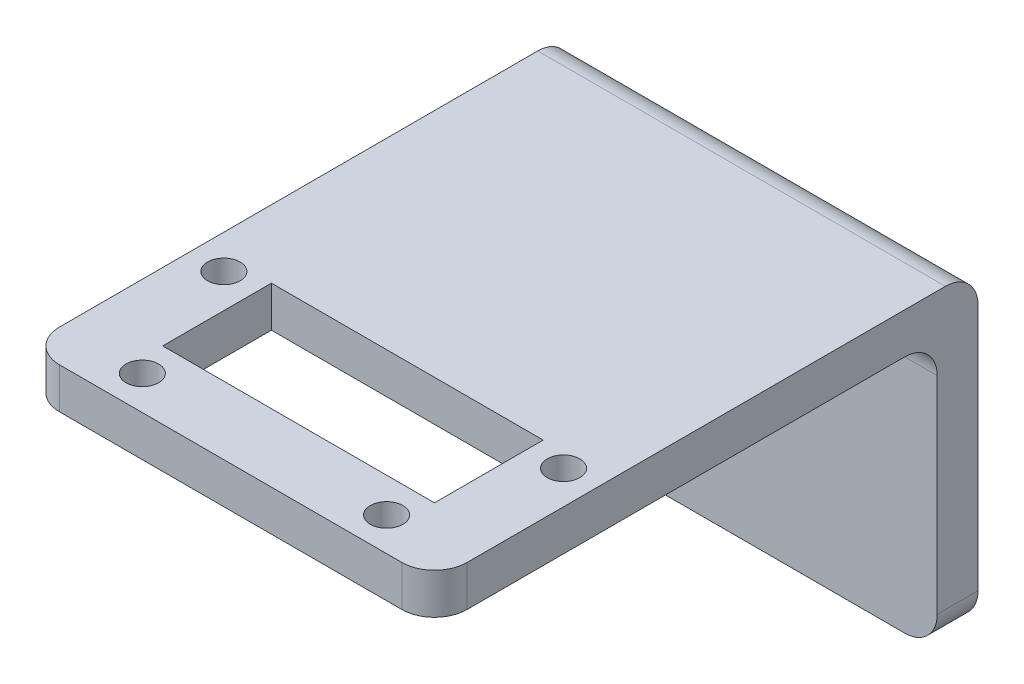
from build123d import *

# Parameters (mm, degrees)
ESBO_O1_W                = 30
ESBO_O1_H                = 40
RESSALTO_EXTRUS_O1_DEPTH = 3
ESBO_O2_W                = 20
ESBO_O2_H                = 8
CORTE_EXTRUS_O1_DEPTH    = 26.179356624
ESBO_O3_R                = 1.2
CORTE_EXTRUS_O2_DEPTH    = 26.179356624
ESBO_O4_W                = 30
ESBO_O4_H                = 3
RESSALTO_EXTRUS_O2_DEPTH = 20
FILETE5_R                = 2.4
FILETE6_R                = 2.4
FILETE7_R                = 2.4
FILETE8_R                = 2.4


with BuildPart() as part:
    # Esboço1 → Ressalto-extrusão1 (new body)
    with BuildSketch(Plane(origin=(0, 0, 0), x_dir=(1, 0, 0), z_dir=(0, 1, 0))):
        Rectangle(ESBO_O1_W, ESBO_O1_H)
    extrude(amount=RESSALTO_EXTRUS_O1_DEPTH)

    # Esboço2 → Corte-extrusão1 (cut, through all)
    with BuildSketch(Plane(origin=(0, 3, 0), x_dir=(1, 0, 0), z_dir=(0, 1, 0))):
        with Locations((0, -11)):
            Rectangle(ESBO_O2_W, ESBO_O2_H)
    extrude(amount=-CORTE_EXTRUS_O1_DEPTH, mode=Mode.SUBTRACT)

    # Esboço3 → Corte-extrusão2 (cut, through all)
    with BuildSketch(Plane.XZ):
        with Locations(Location((-9, 17.5, 0), (0, 0, 270))):
            Circle(ESBO_O3_R)
        with Locations(Location((-12.5, 8, 0), (0, 0, 270))):
            Circle(ESBO_O3_R)
        with Locations(Location((12.545132566, 8.047190753, 0), (0, 0, 90))):
            Circle(ESBO_O3_R)
        with Locations(Location((9.009357204, 17.533933744, 0), (0, 0, 90))):
            Circle(ESBO_O3_R)
    extrude(amount=-CORTE_EXTRUS_O2_DEPTH, mode=Mode.SUBTRACT)

    # Esboço4 → Ressalto-extrusão2 (add)
    with BuildSketch(Plane.XZ):
        with Locations((0, -18.5)):
            Rectangle(ESBO_O4_W, ESBO_O4_H)
    extrude(amount=RESSALTO_EXTRUS_O2_DEPTH)

    # Filete5
    filete5_edges = [part.edges().sort_by_distance(p)[0] for p in [
        (0, 0, -17),
    ]]
    fillet(filete5_edges, radius=FILETE5_R)

    # Filete6
    filete6_edges = [part.edges().sort_by_distance(p)[0] for p in [
        (0, 3, -20),
    ]]
    fillet(filete6_edges, radius=FILETE6_R)

    # Filete7
    filete7_edges = [part.edges().sort_by_distance(p)[0] for p in [
        (15, 1.5, 20),
        (-15, 1.5, 20),
    ]]
    fillet(filete7_edges, radius=FILETE7_R)

    # Filete8
    filete8_edges = [part.edges().sort_by_distance(p)[0] for p in [
        (-15, -20, -18.5),
        (15, -20, -18.5),
    ]]
    fillet(filete8_edges, radius=FILETE8_R)


solid = part.part
